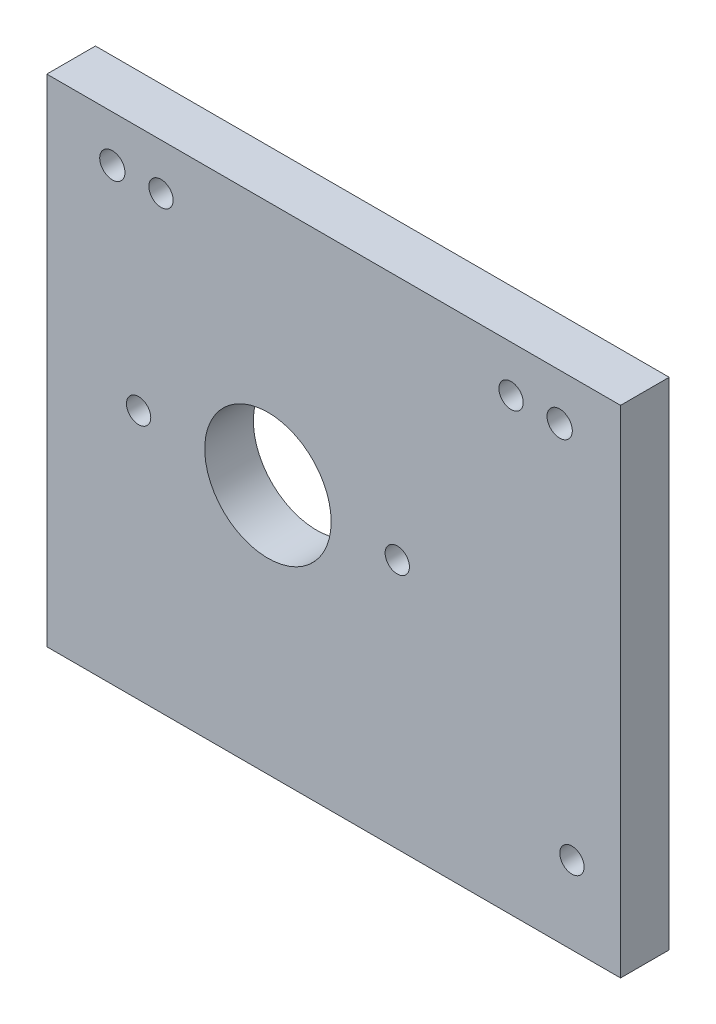
from build123d import *

# Parameters (mm, degrees)
CROQUIS1_W              = 59
CROQUIS1_H              = 51
CROQUIS1_R              = 1.25
CROQUIS1_R_2            = 1.3
CROQUIS1_R_3            = 6.5
SALIENTE_EXTRUIR1_DEPTH = 5


with BuildPart() as part:
    # Croquis1 → Saliente-Extruir1 (new body)
    with BuildSketch(Plane.XY):
        with Locations((-0.238863052, -0.247607665)):
            Rectangle(CROQUIS1_W, CROQUIS1_H)
        with Locations((24.261136948, -17.747607665)):
            Circle(CROQUIS1_R, mode=Mode.SUBTRACT)
        with Locations((-18, 20.5)):
            Circle(CROQUIS1_R, mode=Mode.SUBTRACT)
        with Locations((18, 20.5)):
            Circle(CROQUIS1_R, mode=Mode.SUBTRACT)
        with Locations((-23, 20.5)):
            Circle(CROQUIS1_R_2, mode=Mode.SUBTRACT)
        with Locations((23, 20.5)):
            Circle(CROQUIS1_R_2, mode=Mode.SUBTRACT)
        with Locations((-7, 0)):
            Circle(CROQUIS1_R_3, mode=Mode.SUBTRACT)
        with Locations((-20.3, 0)):
            Circle(CROQUIS1_R, mode=Mode.SUBTRACT)
        with Locations((6.3, 0)):
            Circle(CROQUIS1_R, mode=Mode.SUBTRACT)
    extrude(amount=SALIENTE_EXTRUIR1_DEPTH)


solid = part.part
